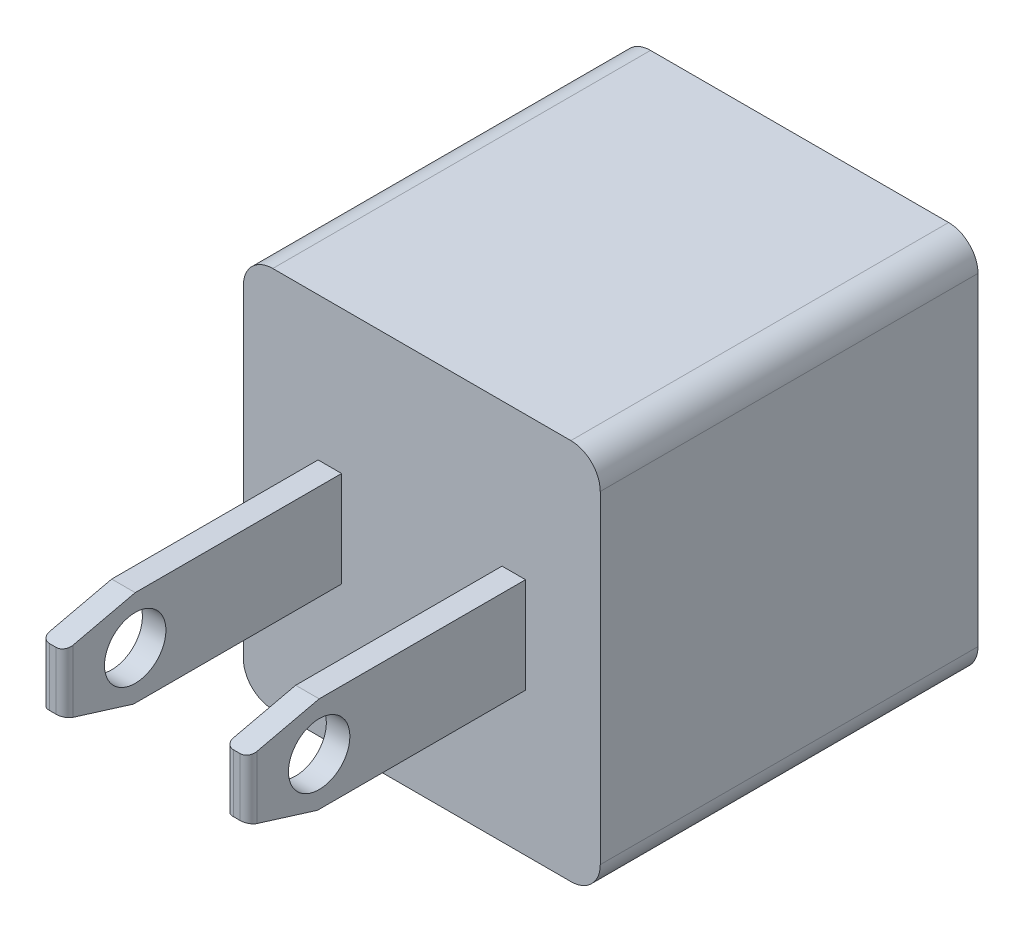
from build123d import *

# Parameters (mm, degrees)
BOSS_EXTRUDE1_DEPTH     = 114.3
SKETCH2_W               = 55.88
SKETCH2_H               = 20.32
CUT_EXTRUDE1_DEPTH      = 58.42
SKETCH4_W               = 7.112
SKETCH4_H               = 28.956
BOSS_EXTRUDE2_DEPTH     = 83.82
CUT_EXTRUDE3_DEPTH      = 81.026
SKETCH8_R               = 9.290672209
CUT_EXTRUDE4_DEPTH      = 81.026
FILLET1_R               = 2.54
CUT_EXTRUDE_THIN1_DEPTH = 2.54


with BuildPart() as part:
    # Sketch1 → Boss-Extrude1 (new body)
    with BuildSketch(Plane.XY):
        with BuildLine():
            Line((45.101951145, 57.785), (-45.101951145, 57.785))
            ThreePointArc((-45.101951145, 57.785), (-51.38813043, 55.181179285), (-53.991951145, 48.895))
            Line((-53.991951145, 48.895), (-53.991951145, -48.895))
            ThreePointArc((-53.991951145, -48.895), (-51.38813043, -55.181179285), (-45.101951145, -57.785))
            Line((-45.101951145, -57.785), (45.101951145, -57.785))
            ThreePointArc((45.101951145, -57.785), (51.38813043, -55.181179285), (53.991951145, -48.895))
            Line((53.991951145, -48.895), (53.991951145, 48.895))
            ThreePointArc((53.991951145, 48.895), (51.38813043, 55.181179285), (45.101951145, 57.785))
        make_face()
    extrude(amount=BOSS_EXTRUDE1_DEPTH)

    # Sketch2 → Cut-Extrude1 (cut)
    with BuildSketch(Plane(origin=(0, 0, 0), x_dir=(-1, 0, 0), z_dir=(0, 0, -1))):
        with Locations((0, -32.385)):
            Rectangle(SKETCH2_W, SKETCH2_H)
    extrude(amount=-CUT_EXTRUDE1_DEPTH, mode=Mode.SUBTRACT)

    # Sketch4 → Boss-Extrude2 (add)
    with BuildSketch(Plane.XY.offset(114.3)):
        with Locations((-27.829951145, 0)):
            Rectangle(SKETCH4_W, SKETCH4_H)
        with Locations((27.829951145, 0)):
            Rectangle(SKETCH4_W, SKETCH4_H)
    extrude(amount=BOSS_EXTRUDE2_DEPTH)

    # Sketch7 → Cut-Extrude3 (cut)
    with BuildSketch(Plane(origin=(31.385951145, 0, 0), x_dir=(0, 0, -1), z_dir=(1, 0, 0))):
        Polygon((-214.942074504, -34.200153794), (-240.17713944, 1.162141148), (-200.137312033, 42.544769544), (-200.137312033, 40.508920027), (-166.132146275, 16.934056733), (-214.942074504, 5.644685578), (-204.648824334, -5.976725906), (-166.132146275, -17.930177717), align=None)
    extrude(amount=-CUT_EXTRUDE3_DEPTH, mode=Mode.SUBTRACT)

    # Sketch8 → Cut-Extrude4 (cut)
    with BuildSketch(Plane(origin=(31.385951145, 0, 0), x_dir=(0, 0, -1), z_dir=(1, 0, 0))):
        with Locations(Location((-176.750979796, 0, 0), (0, 0, 90))):
            Circle(SKETCH8_R)
    extrude(amount=-CUT_EXTRUDE4_DEPTH, mode=Mode.SUBTRACT)

    # Fillet1
    fillet1_edges = [part.edges().sort_by_distance(p)[0] for p in [
        (31.385951145, 0.766296382, 198.12),
        (24.273951145, 0.766296382, 198.12),
        (-31.385951145, 0.766296382, 198.12),
        (-24.273951145, 0.766296382, 198.12),
    ]]
    fillet(fillet1_edges, radius=FILLET1_R)

    # Sketch9 → Cut-Extrude-Thin1 (cut)
    with BuildSketch(Plane(origin=(0, 0, 0), x_dir=(-1, 0, 0), z_dir=(0, 0, -1))):
        with BuildLine():
            Line((-45.101951145, -53.146398513), (45.101951145, -53.146398513))
            ThreePointArc((45.101951145, -53.146398513), (48.108143863, -51.901192718), (49.353349658, -48.895))
            Line((49.353349658, -48.895), (49.353349658, 48.895))
            ThreePointArc((49.353349658, 48.895), (48.108143863, 51.901192718), (45.101951145, 53.146398513))
            Line((45.101951145, 53.146398513), (-45.101951145, 53.146398513))
            ThreePointArc((-45.101951145, 53.146398513), (-48.108143863, 51.901192718), (-49.353349658, 48.895))
            Line((-49.353349658, 48.895), (-49.353349658, -48.895))
            ThreePointArc((-49.353349658, -48.895), (-48.108143863, -51.901192718), (-45.101951145, -53.146398513))
        make_face()
        with BuildLine():
            Line((-45.101951145, -52.638398513), (45.101951145, -52.638398513))
            ThreePointArc((45.101951145, -52.638398513), (47.748933618, -51.541982473), (48.845349658, -48.895))
            Line((48.845349658, -48.895), (48.845349658, 48.895))
            ThreePointArc((48.845349658, 48.895), (47.748933618, 51.541982473), (45.101951145, 52.638398513))
            Line((45.101951145, 52.638398513), (-45.101951145, 52.638398513))
            ThreePointArc((-45.101951145, 52.638398513), (-47.748933618, 51.541982473), (-48.845349658, 48.895))
            Line((-48.845349658, 48.895), (-48.845349658, -48.895))
            ThreePointArc((-48.845349658, -48.895), (-47.748933618, -51.541982473), (-45.101951145, -52.638398513))
        make_face(mode=Mode.SUBTRACT)
    extrude(amount=-CUT_EXTRUDE_THIN1_DEPTH, mode=Mode.SUBTRACT)


solid = part.part
